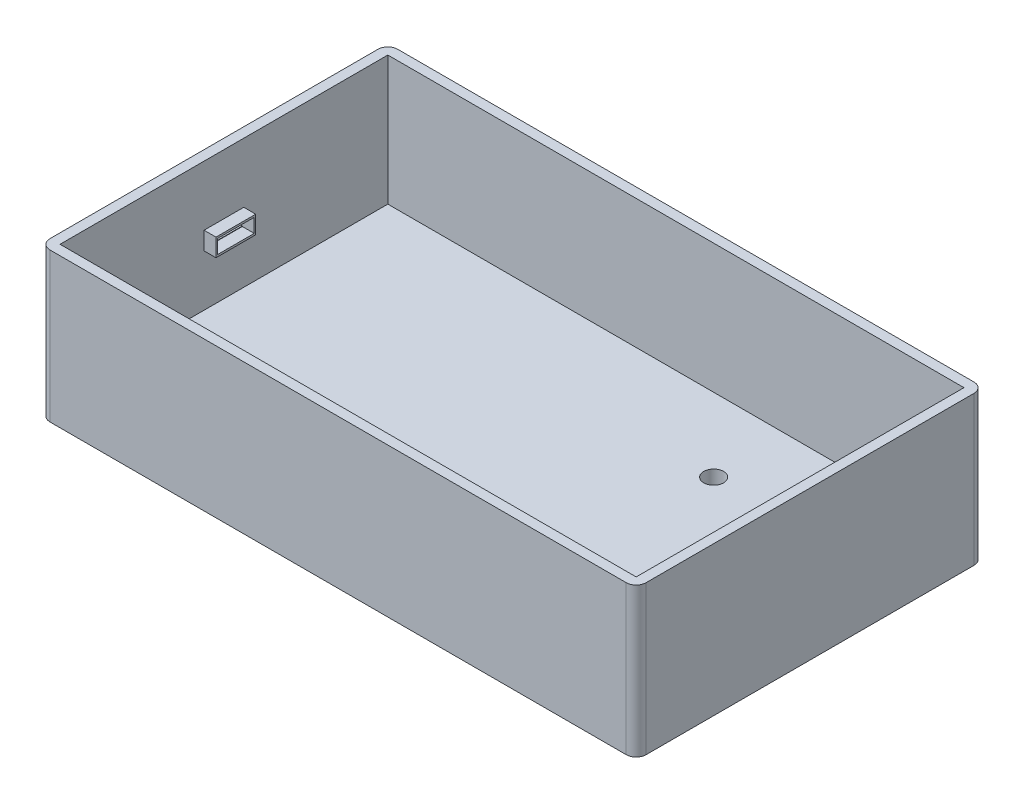
from build123d import *

# Parameters (mm, degrees)
SKETCH1_W           = 152.4
SKETCH1_H           = 88.9
BOSS_EXTRUDE1_DEPTH = 38.1
SKETCH2_W           = 147.32
SKETCH2_H           = 83.82
CUT_EXTRUDE1_DEPTH  = 33.02
SKETCH5_W           = 9.398
SKETCH5_H           = 3.429
CUT_EXTRUDE3_DEPTH  = 2.54
FILLET1_R           = 2.54
SKETCH6_R           = 2.54
CUT_EXTRUDE4_DEPTH  = 95.194282735
SKETCH7_W           = 10.16
SKETCH7_H           = 4.572
SKETCH7_W_2         = 9.398
SKETCH7_H_2         = 3.556
BOSS_EXTRUDE2_DEPTH = 3.048


with BuildPart() as part:
    # Sketch1 → Boss-Extrude1 (new body)
    with BuildSketch(Plane(origin=(0, 0, 0), x_dir=(1, 0, 0), z_dir=(0, 1, 0))):
        Rectangle(SKETCH1_W, SKETCH1_H)
    extrude(amount=BOSS_EXTRUDE1_DEPTH)

    # Sketch2 → Cut-Extrude1 (cut)
    with BuildSketch(Plane(origin=(0, 38.1, 0), x_dir=(1, 0, 0), z_dir=(0, 1, 0))):
        Rectangle(SKETCH2_W, SKETCH2_H)
    extrude(amount=-CUT_EXTRUDE1_DEPTH, mode=Mode.SUBTRACT)

    # Sketch5 → Cut-Extrude3 (cut)
    with BuildSketch(Plane.ZY.offset(76.2)):
        with Locations((0, 20.574)):
            Rectangle(SKETCH5_W, SKETCH5_H)
    extrude(amount=-CUT_EXTRUDE3_DEPTH, mode=Mode.SUBTRACT)

    # Fillet1
    fillet1_edges = [part.edges().sort_by_distance(p)[0] for p in [
        (76.2, 19.05, 44.45),
        (-76.2, 19.05, 44.45),
        (-76.2, 19.05, -44.45),
        (76.2, 19.05, -44.45),
    ]]
    fillet(fillet1_edges, radius=FILLET1_R)

    # Sketch6 → Cut-Extrude4 (cut, through all)
    with BuildSketch(Plane(origin=(0, 5.08, 0), x_dir=(1, 0, 0), z_dir=(0, 1, 0))):
        with Locations(Location((28.448, 23.114, 0), (0, 0, 270))):
            Circle(SKETCH6_R)
        with Locations(Location((28.448, -23.114, 0), (0, 0, 90))):
            Circle(SKETCH6_R)
    extrude(amount=-CUT_EXTRUDE4_DEPTH, mode=Mode.SUBTRACT)

    # Sketch7 → Boss-Extrude2 (add)
    with BuildSketch(Plane(origin=(-73.66, 0, 0), x_dir=(0, 0, -1), z_dir=(1, 0, 0))):
        with Locations((0, 20.5105)):
            Rectangle(SKETCH7_W, SKETCH7_H)
        with Locations((0, 20.5105)):
            Rectangle(SKETCH7_W_2, SKETCH7_H_2, mode=Mode.SUBTRACT)
    extrude(amount=BOSS_EXTRUDE2_DEPTH)


solid = part.part
